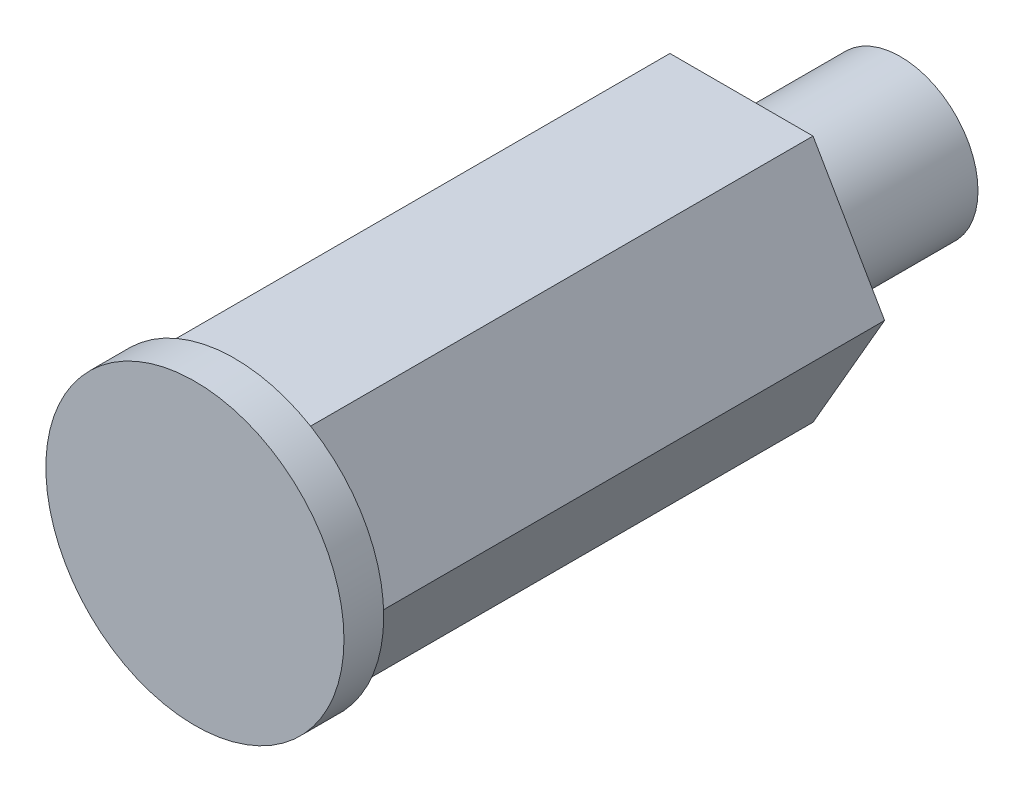
from build123d import *

# Parameters (mm, degrees)
SKETCH1_R           = 3.9
BOSS_EXTRUDE1_DEPTH = 8
BOSS_EXTRUDE2_DEPTH = 25.5
SKETCH3_R           = 7.5
BOSS_EXTRUDE3_DEPTH = 2


with BuildPart() as part:
    # Sketch1 → Boss-Extrude1 (new body)
    with BuildSketch(Plane.XY):
        Circle(SKETCH1_R)
        with BuildLine():
            Line((-2.080769089, -2.02), (-2.080769089, 2.02))
            ThreePointArc((-2.080769089, 2.02), (0, 2.9), (2.080769089, 2.02))
            Line((2.080769089, 2.02), (2.080769089, -2.02))
            ThreePointArc((2.080769089, -2.02), (0, -2.9), (-2.080769089, -2.02))
        make_face(mode=Mode.SUBTRACT)
    extrude(amount=BOSS_EXTRUDE1_DEPTH)

    # Sketch2 → Boss-Extrude2 (add)
    with BuildSketch(Plane.XY.offset(8)):
        Polygon((3.6, 6.235382907), (-3.6, 6.235382907), (-7.2, 0), (-3.6, -6.235382907), (3.6, -6.235382907), (7.2, 0), align=None)
    extrude(amount=BOSS_EXTRUDE2_DEPTH)

    # Sketch3 → Boss-Extrude3 (add)
    with BuildSketch(Plane.XY.offset(33.5)):
        Circle(SKETCH3_R)
    extrude(amount=BOSS_EXTRUDE3_DEPTH)


solid = part.part
